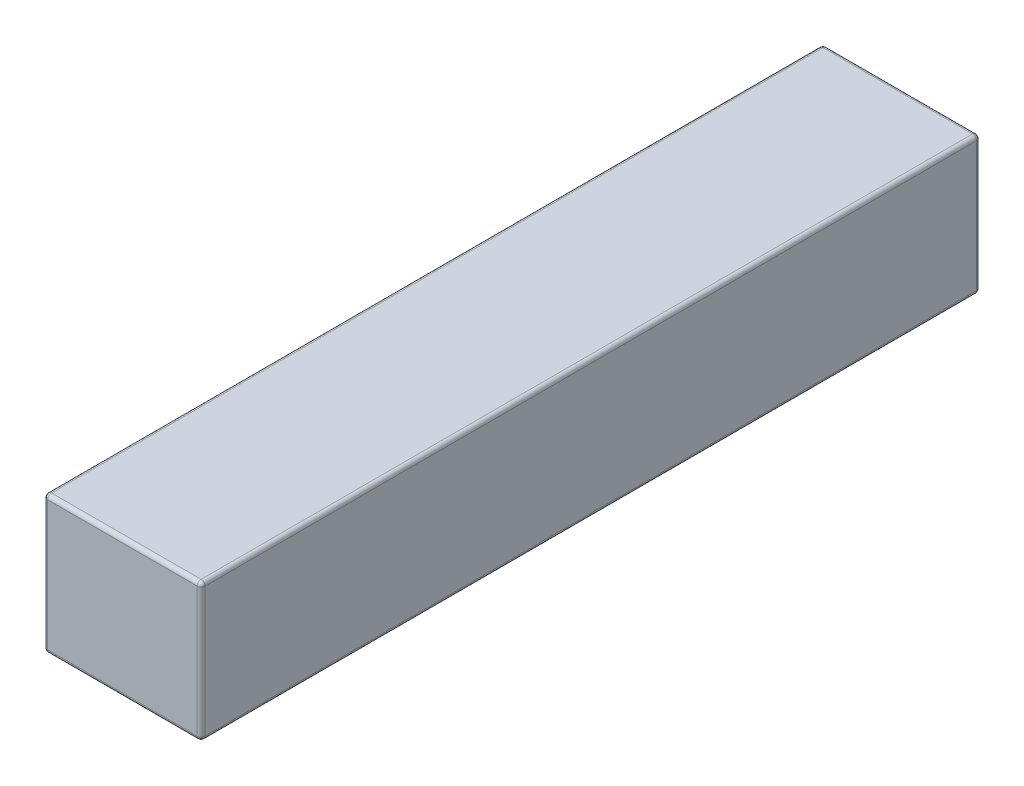
from build123d import *

# Parameters (mm, degrees)
SKETCH1_W           = 400
SKETCH1_H           = 350
BOSS_EXTRUDE1_DEPTH = 1980
FILLET1_R           = 10


with BuildPart() as part:
    # Sketch1 → Boss-Extrude1 (new body)
    with BuildSketch(Plane.XY):
        Rectangle(SKETCH1_W, SKETCH1_H)
    extrude(amount=BOSS_EXTRUDE1_DEPTH)

    # Fillet1
    fillet1_edges = [part.edges().sort_by_distance(p)[0] for p in [
        (200, 0, 1980),
        (0, 175, 1980),
        (-200, 0, 1980),
        (0, 175, 0),
        (200, 0, 0),
        (0, -175, 0),
        (-200, 0, 0),
        (0, -175, 1980),
        (-200, 175, 990),
        (200, 175, 990),
        (200, -175, 990),
        (-200, -175, 990),
    ]]
    fillet(fillet1_edges, radius=FILLET1_R)


solid = part.part
